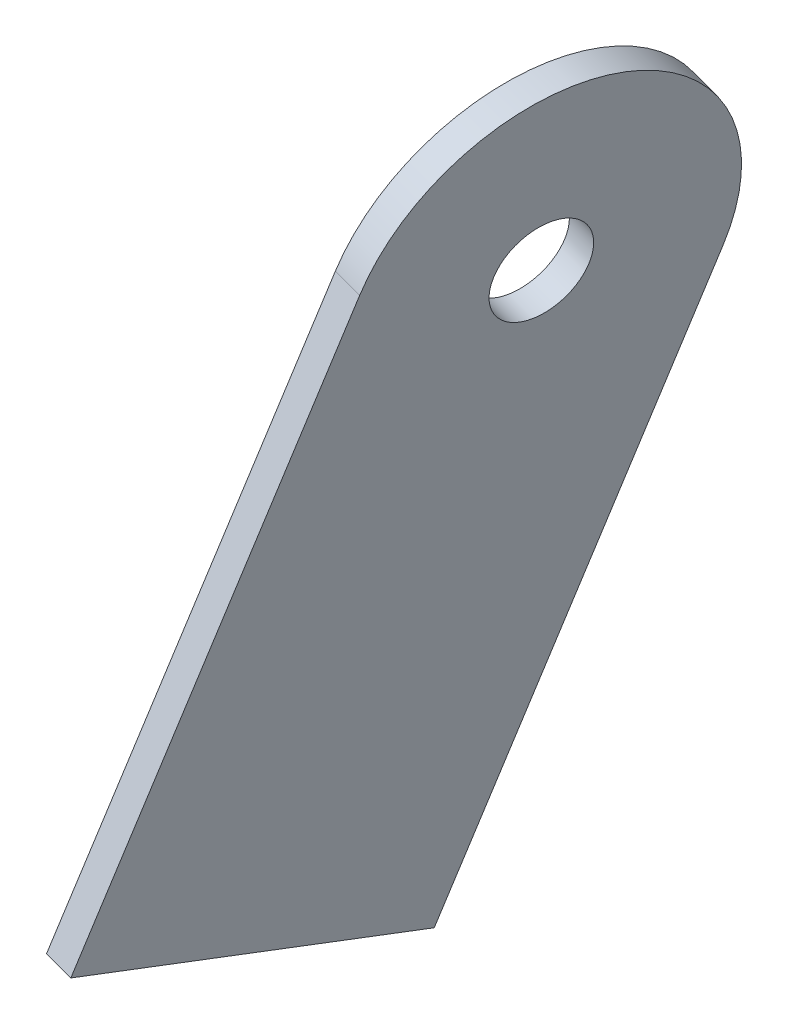
from build123d import *

# Parameters (mm, degrees)
SKETCH1_R           = 2.4892
BOSS_EXTRUDE1_DEPTH = 1.5875


with BuildPart() as part:
    # Sketch1 → Boss-Extrude1 (new body)
    with BuildSketch(Plane(origin=(-406.434347041, 66.988247001, -60.080441698), x_dir=(-0.14240696456357832, 0.02347142407205886, 0.9895298624578327), z_dir=(-0.9763571476802022, 0.16092255550294132, -0.1443282761768555))):
        with BuildLine():
            Line((-412.136977902, 178.798512371), (-421.512544605, 210.184151026))
            ThreePointArc((-421.512544605, 210.184151026), (-415.112326577, 222.036933788), (-403.259543815, 215.636715759))
            Line((-403.259543815, 215.636715759), (-393.883977112, 184.251077104))
            Line((-393.883977112, 184.251077104), (-412.136977902, 178.798512371))
        make_face()
        with Locations(Location((-412.38604421, 212.910433393, 0), (0, 0, 270))):
            Circle(SKETCH1_R, mode=Mode.SUBTRACT)
    extrude(amount=BOSS_EXTRUDE1_DEPTH)


solid = part.part
